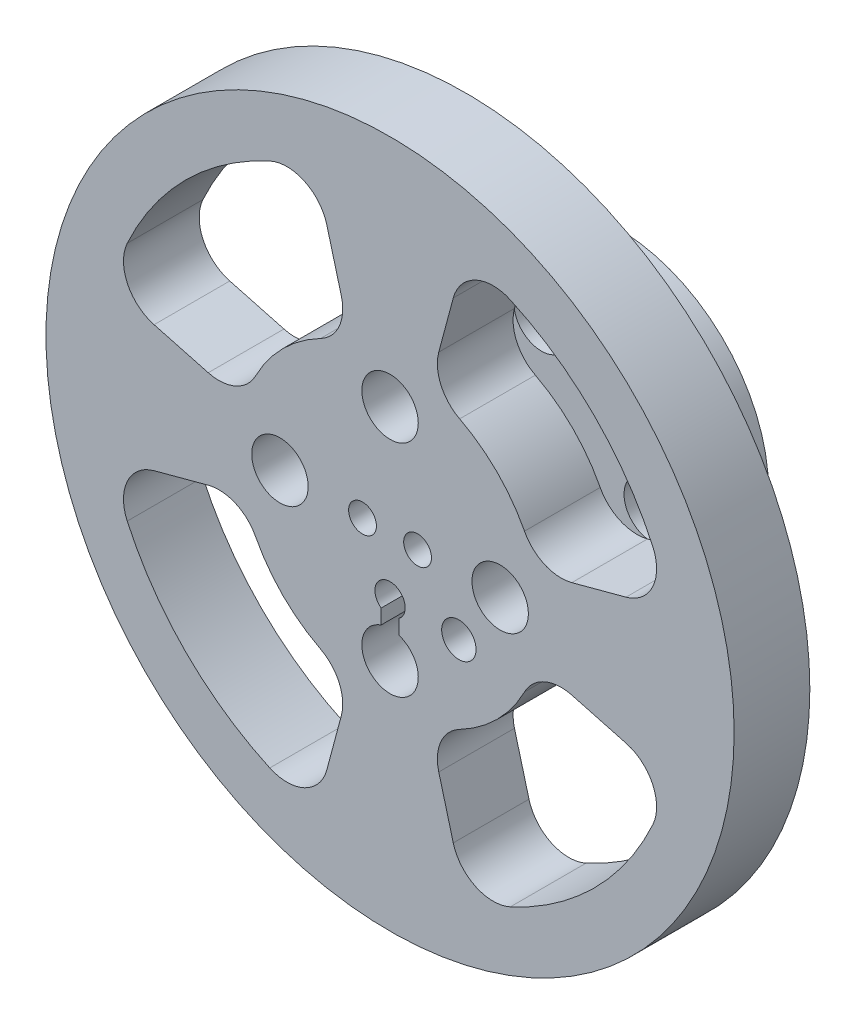
from build123d import *

# Parameters (mm, degrees)
SKETCH_1_R          = 11
SKETCH_1_R_2        = 1.15
EXTRUDE_1_DEPTH     = 5.5
SKETCH_2_R          = 3
EXTRUDE_2_DEPTH     = 5.5
SKETCH_3_R          = 25
SKETCH_3_R_2        = 2.05
EXTRUDE_3_DEPTH     = 5.5
CUT_EXTRUDE_START   = -16.5
SKETCH_8_R          = 1.01
CUT_EXTRUDE_4_DEPTH = 16.5
SKETCH_9_R          = 0.8
CUT_EXTRUDE_5_DEPTH = 5.5
SKETCH_12_R         = 2
CUT_EXTRUDE_7_DEPTH = 2.5
SKETCH_13_R         = 1.1
CUT_EXTRUDE_8_DEPTH = 5.5
SKETCH_14_R         = 1.25
SKETCH_14_W         = 1.3
SKETCH_14_H         = 1.068365823
CUT_EXTRUDE_9_DEPTH = 5.5


with BuildPart() as part:
    # ｽｹｯﾁ1 → ﾎﾞｽ - 押し出し1 (new body)
    with BuildSketch(Plane.XY):
        Circle(SKETCH_1_R)
        with Locations((-8, 0)):
            Circle(SKETCH_1_R_2, mode=Mode.SUBTRACT)
        with Locations((0, 8)):
            Circle(SKETCH_1_R_2, mode=Mode.SUBTRACT)
        with Locations((8, 0)):
            Circle(SKETCH_1_R_2, mode=Mode.SUBTRACT)
        with Locations((0, -8)):
            Circle(SKETCH_1_R_2, mode=Mode.SUBTRACT)
    extrude(amount=EXTRUDE_1_DEPTH)

    # ｽｹｯﾁ9 → ｶｯﾄ - 押し出し5 (cut)
    with BuildSketch(Plane.XY.offset(5.5)):
        with Locations((-2, 0)):
            Circle(SKETCH_9_R)
        with Locations((2, 0)):
            Circle(SKETCH_9_R)
    extrude(amount=-CUT_EXTRUDE_5_DEPTH, mode=Mode.SUBTRACT)

    # ｽｹｯﾁ12 → ｶｯﾄ - 押し出し7 (cut)
    with BuildSketch(Plane.XY.offset(5.5)):
        with Locations((-8, 0)):
            Circle(SKETCH_12_R)
        with Locations((0, 8)):
            Circle(SKETCH_12_R)
        with Locations((8, 0)):
            Circle(SKETCH_12_R)
        with Locations((0, -8)):
            Circle(SKETCH_12_R)
    extrude(amount=-CUT_EXTRUDE_7_DEPTH, mode=Mode.SUBTRACT)


with BuildPart() as body_2:
    # ｽｹｯﾁ2 → ﾎﾞｽ - 押し出し2 (new body)
    with BuildSketch(Plane.XY.offset(5.5)):
        Circle(SKETCH_2_R)
    extrude(amount=EXTRUDE_2_DEPTH)


with BuildPart() as body_3:
    # ｽｹｯﾁ3 → ﾎﾞｽ - 押し出し3 (new body)
    with BuildSketch(Plane.XY.offset(11)):
        Circle(SKETCH_3_R)
        with Locations((-8, 0)):
            Circle(SKETCH_3_R_2, mode=Mode.SUBTRACT)
        with Locations((0, 8)):
            Circle(SKETCH_3_R_2, mode=Mode.SUBTRACT)
        with Locations((8, 0)):
            Circle(SKETCH_3_R_2, mode=Mode.SUBTRACT)
        with Locations((0, -8)):
            Circle(SKETCH_3_R_2, mode=Mode.SUBTRACT)
        with BuildLine():
            Line((3.539297211, 13.208837014), (4.593582361, 17.143482759))
            ThreePointArc((4.593582361, 17.143482759), (6.213881453, 19.081440656), (8.739919813, 19.094863227))
            ThreePointArc((8.739919813, 19.094863227), (14.849242405, 14.849242405), (19.094863227, 8.739919813))
            ThreePointArc((19.094863227, 8.739919813), (19.081440656, 6.213881453), (17.143482759, 4.593582361))
            Line((17.143482759, 4.593582361), (13.208837014, 3.539297211))
            ThreePointArc((13.208837014, 3.539297211), (11.221112248, 3.692474404), (9.768298476, 5.057701542))
            ThreePointArc((9.768298476, 5.057701542), (7.778174593, 7.778174593), (5.057701542, 9.768298476))
            ThreePointArc((5.057701542, 9.768298476), (3.692474404, 11.221112248), (3.539297211, 13.208837014))
        make_face(mode=Mode.SUBTRACT)
        with BuildLine():
            Line((13.208837014, -3.539297211), (17.143482759, -4.593582361))
            ThreePointArc((17.143482759, -4.593582361), (19.081440656, -6.213881453), (19.094863227, -8.739919813))
            ThreePointArc((19.094863227, -8.739919813), (14.849242405, -14.849242405), (8.739919813, -19.094863227))
            ThreePointArc((8.739919813, -19.094863227), (6.213881453, -19.081440656), (4.593582361, -17.143482759))
            Line((4.593582361, -17.143482759), (3.539297211, -13.208837014))
            ThreePointArc((3.539297211, -13.208837014), (3.692474404, -11.221112248), (5.057701542, -9.768298476))
            ThreePointArc((5.057701542, -9.768298476), (7.778174593, -7.778174593), (9.768298476, -5.057701542))
            ThreePointArc((9.768298476, -5.057701542), (11.221112248, -3.692474404), (13.208837014, -3.539297211))
        make_face(mode=Mode.SUBTRACT)
        with BuildLine():
            Line((-3.539297211, -13.208837014), (-4.593582361, -17.143482759))
            ThreePointArc((-4.593582361, -17.143482759), (-6.213881453, -19.081440656), (-8.739919813, -19.094863227))
            ThreePointArc((-8.739919813, -19.094863227), (-14.849242405, -14.849242405), (-19.094863227, -8.739919813))
            ThreePointArc((-19.094863227, -8.739919813), (-19.081440656, -6.213881453), (-17.143482759, -4.593582361))
            Line((-17.143482759, -4.593582361), (-13.208837014, -3.539297211))
            ThreePointArc((-13.208837014, -3.539297211), (-11.221112248, -3.692474404), (-9.768298476, -5.057701542))
            ThreePointArc((-9.768298476, -5.057701542), (-7.778174593, -7.778174593), (-5.057701542, -9.768298476))
            ThreePointArc((-5.057701542, -9.768298476), (-3.692474404, -11.221112248), (-3.539297211, -13.208837014))
        make_face(mode=Mode.SUBTRACT)
        with BuildLine():
            Line((-13.208837014, 3.539297211), (-17.143482759, 4.593582361))
            ThreePointArc((-17.143482759, 4.593582361), (-19.081440656, 6.213881453), (-19.094863227, 8.739919813))
            ThreePointArc((-19.094863227, 8.739919813), (-14.849242405, 14.849242405), (-8.739919813, 19.094863227))
            ThreePointArc((-8.739919813, 19.094863227), (-6.213881453, 19.081440656), (-4.593582361, 17.143482759))
            Line((-4.593582361, 17.143482759), (-3.539297211, 13.208837014))
            ThreePointArc((-3.539297211, 13.208837014), (-3.692474404, 11.221112248), (-5.057701542, 9.768298476))
            ThreePointArc((-5.057701542, 9.768298476), (-7.778174593, 7.778174593), (-9.768298476, 5.057701542))
            ThreePointArc((-9.768298476, 5.057701542), (-11.221112248, 3.692474404), (-13.208837014, 3.539297211))
        make_face(mode=Mode.SUBTRACT)
    extrude(amount=EXTRUDE_3_DEPTH)


with BuildPart() as cut_extrude_4_tool:
    # ｽｹｯﾁ8 → ｶｯﾄ - 押し出し4 (new body)
    with BuildSketch(Plane.XY.offset(16.5).offset(CUT_EXTRUDE_START)):
        with Locations((-2, 0)):
            Circle(SKETCH_8_R)
        with Locations((2, 0)):
            Circle(SKETCH_8_R)
    extrude(amount=CUT_EXTRUDE_4_DEPTH)


with BuildPart() as body_2_1:
    add(body_2.part)

    # ｶｯﾄ - 押し出し4: cut by cut_extrude_4_tool
    add(cut_extrude_4_tool.part, mode=Mode.SUBTRACT)


with BuildPart() as body_3_1:
    add(body_3.part)

    # ｶｯﾄ - 押し出し4: cut by cut_extrude_4_tool
    add(cut_extrude_4_tool.part, mode=Mode.SUBTRACT)

    # ｽｹｯﾁ13 → ｶｯﾄ - 押し出し8 (cut)
    with BuildSketch(Plane.XY.offset(16.5)):
        with Locations((0, -4.1)):
            Circle(SKETCH_13_R)
    extrude(amount=-CUT_EXTRUDE_8_DEPTH, mode=Mode.SUBTRACT)

    # ｽｹｯﾁ14 → ｶｯﾄ - 押し出し9 (cut)
    with BuildSketch(Plane.XY.offset(16.5)):
        with Locations((4.999712068, -4.153658537)):
            Circle(SKETCH_14_R)
        with Locations((0, -5.521594879)):
            Rectangle(SKETCH_14_W, SKETCH_14_H)
    extrude(amount=-CUT_EXTRUDE_9_DEPTH, mode=Mode.SUBTRACT)


solid = Compound([part.part, body_2_1.part, body_3_1.part])
